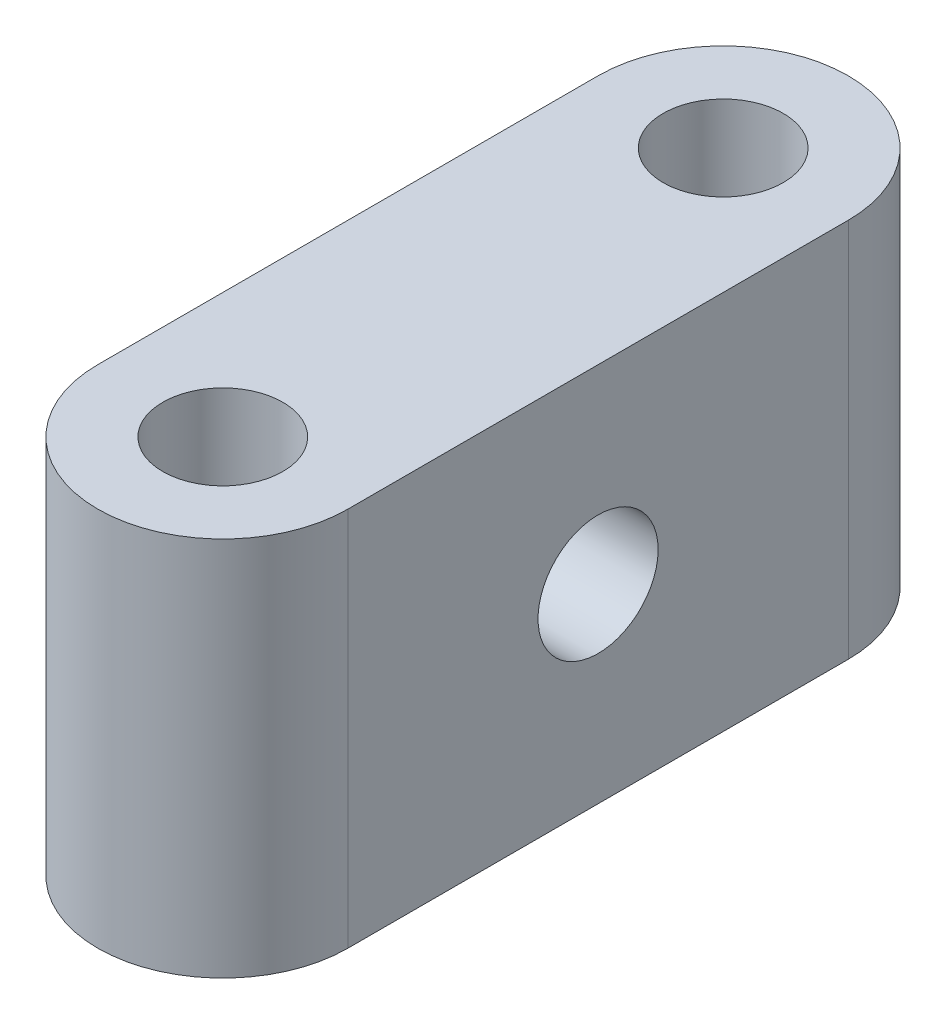
from build123d import *

# Parameters (mm, degrees)
SKETCH2_R           = 6
BOSS_EXTRUDE1_DEPTH = 19
SKETCH5_R           = 6
CUT_EXTRUDE1_DEPTH  = 12.5


with BuildPart() as part:
    # Sketch2 → Boss-Extrude1 (new, symmetric)
    with BuildSketch(Plane(origin=(0, 0, 0), x_dir=(1, 0, 0), z_dir=(0, 1, 0))):
        with BuildLine():
            Line((-12.5, -25), (-12.5, 25))
            ThreePointArc((-12.5, 25), (0, 37.5), (12.5, 25))
            Line((12.5, 25), (12.5, -25))
            ThreePointArc((12.5, -25), (0, -37.5), (-12.5, -25))
        make_face()
        with Locations(Location((0, 25, 0), (0, 0, 270))):
            Circle(SKETCH2_R, mode=Mode.SUBTRACT)
        with Locations(Location((0, -25, 0), (0, 0, 270))):
            Circle(SKETCH2_R, mode=Mode.SUBTRACT)
    extrude(amount=BOSS_EXTRUDE1_DEPTH, both=True)

    # Sketch5 → Cut-Extrude1 (cut)
    with BuildSketch(Plane(origin=(12.5, 0, 0), x_dir=(0, 0, -1), z_dir=(1, 0, 0))):
        Circle(SKETCH5_R)
    extrude(amount=-CUT_EXTRUDE1_DEPTH, mode=Mode.SUBTRACT)


solid = part.part
